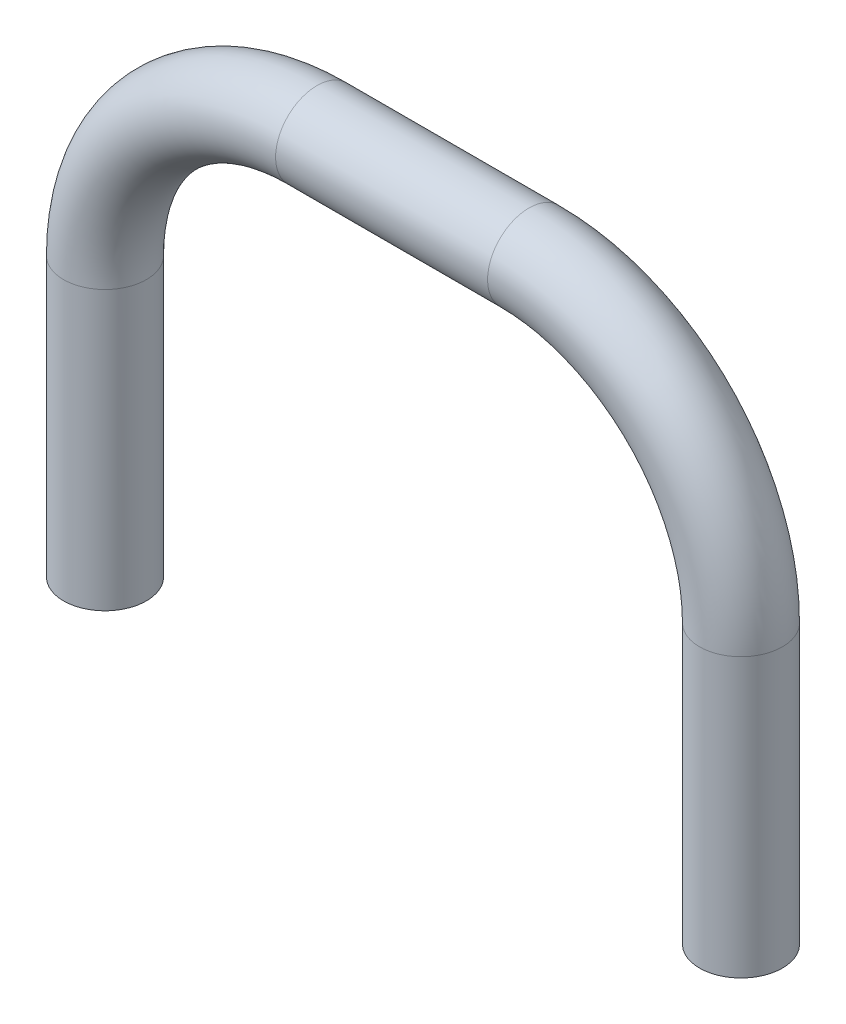
from build123d import *

# Parameters (mm, degrees)
SKETCH2_R          = 39.6875
SKETCH3_R          = 38.1
CUT_EXTRUDE1_DEPTH = 256.54
SKETCH4_R          = 38.1
CUT_EXTRUDE2_DEPTH = 261.62


with BuildPart() as part:
    # Sweep1: sweep along a path in Sketch1
    with BuildLine(Plane.XY) as sweep1_path:
        Line((0, 0), (0, 266.7))
        ThreePointArc((0, 266.7), (59.515902063, 410.384097937), (203.2, 469.9))
        Line((203.2, 469.9), (406.4, 469.9))
        ThreePointArc((406.4, 469.9), (550.084097937, 410.384097937), (609.6, 266.7))
        Line((609.6, 266.7), (609.6, 0))
    # Sketch2 → Sweep1 (sweep)
    with BuildSketch(Plane(origin=(0, 0, 0), x_dir=(1, 0, 0), z_dir=(0, 1, 0))):
        Circle(SKETCH2_R)
    sweep(path=sweep1_path.line)

    # Sketch3 → Cut-Extrude1 (cut)
    with BuildSketch(Plane.XZ):
        with Locations(Location((0, 0, 0), (0, 0, 270))):
            Circle(SKETCH3_R)
    extrude(amount=-CUT_EXTRUDE1_DEPTH, mode=Mode.SUBTRACT)

    # Sketch4 → Cut-Extrude2 (cut)
    with BuildSketch(Plane.XZ):
        with Locations((609.6, 0)):
            Circle(SKETCH4_R)
    extrude(amount=-CUT_EXTRUDE2_DEPTH, mode=Mode.SUBTRACT)


solid = part.part
